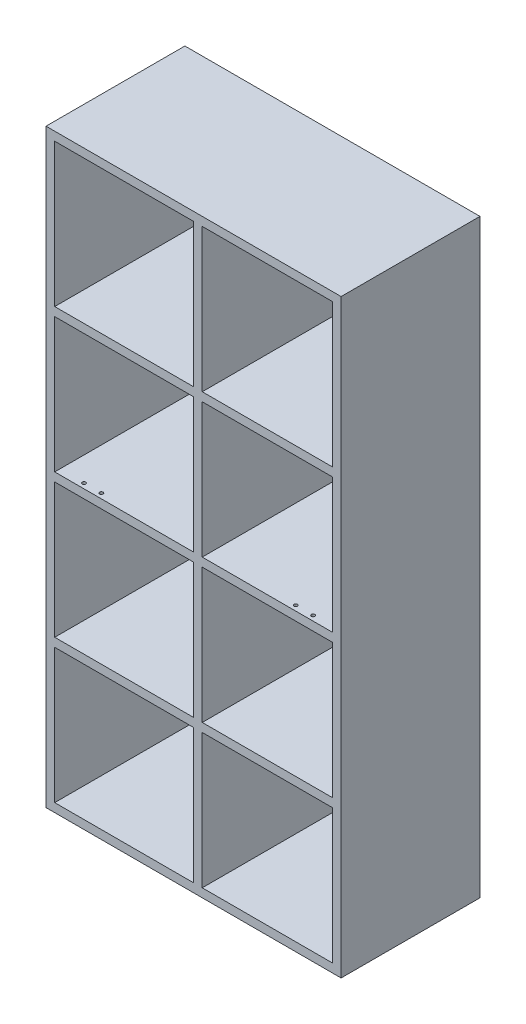
from build123d import *

# Parameters (mm, degrees)
SZKIC1_W                          = 850
SZKIC1_H                          = 1700
SZKIC1_W_2                        = 800
SZKIC1_H_2                        = 1650
SZKIC1_H_3                        = 25
SZKIC1_W_3                        = 25
WYCI_GNI_CIE_CIENKA_CIANKA1_DEPTH = 400
SZKIC2_R                          = 5
WYTNIJ_WYCI_GNI_CIE1_DEPTH        = 25
SZKIC4_R                          = 5
WYTNIJ_WYCI_GNI_CIE2_DEPTH        = 25
SZKIC6_R                          = 5
WYTNIJ_WYCI_GNI_CIE3_DEPTH        = 40


with BuildPart() as part:
    # Szkic1 → Wyciągnięcie-cienka ścianka1 (new body)
    # profile 1 of 5: a face of its own
    with BuildSketch(Plane.XY):
        with Locations((400, 825)):
            Rectangle(SZKIC1_W, SZKIC1_H)
        with Locations((400, 825)):
            Rectangle(SZKIC1_W_2, SZKIC1_H_2, mode=Mode.SUBTRACT)
    # profile 2 of 5: a face of its own
    with BuildSketch(Plane.XY):
        with Locations((400, 400)):
            Rectangle(SZKIC1_W_2, SZKIC1_H_3)
    # profile 3 of 5: a face of its own
    with BuildSketch(Plane.XY):
        with Locations((412.5, 825)):
            Rectangle(SZKIC1_W_3, SZKIC1_H_2)
    # profile 4 of 5: a face of its own
    with BuildSketch(Plane.XY):
        with Locations((400, 812.5)):
            Rectangle(SZKIC1_W_2, SZKIC1_H_3)
    # profile 5 of 5: a face of its own
    with BuildSketch(Plane.XY):
        with Locations((400, 1225)):
            Rectangle(SZKIC1_W_2, SZKIC1_H_3)
    extrude(amount=WYCI_GNI_CIE_CIENKA_CIANKA1_DEPTH)

    # Szkic2 → Wytnij-wyciągnięcie1 (cut)
    with BuildSketch(Plane(origin=(0, 825, 0), x_dir=(1, 0, 0), z_dir=(0, 1, 0))):
        with Locations(Location((70, -385.65, 0), (0, 0, 270))):
            Circle(SZKIC2_R)
        with Locations(Location((120, -385.65, 0), (0, 0, 270))):
            Circle(SZKIC2_R)
    extrude(amount=-WYTNIJ_WYCI_GNI_CIE1_DEPTH, mode=Mode.SUBTRACT)

    # Szkic4 → Wytnij-wyciągnięcie2 (cut)
    with BuildSketch(Plane(origin=(0, 825, 0), x_dir=(1, 0, 0), z_dir=(0, 1, 0))):
        with Locations(Location((730, -385.65, 0), (0, 0, 270))):
            Circle(SZKIC4_R)
        with Locations(Location((680, -385.65, 0), (0, 0, 270))):
            Circle(SZKIC4_R)
    extrude(amount=-WYTNIJ_WYCI_GNI_CIE2_DEPTH, mode=Mode.SUBTRACT)

    # Szkic6 → Wytnij-wyciągnięcie3 (cut)
    with BuildSketch(Plane.ZY.offset(25)):
        with Locations(Location((72.001673976, 1663, 0), (0, 0, 270))):
            Circle(SZKIC6_R)
        with Locations(Location((152.811673976, 1663, 0), (0, 0, 270))):
            Circle(SZKIC6_R)
    extrude(amount=-WYTNIJ_WYCI_GNI_CIE3_DEPTH, mode=Mode.SUBTRACT)


solid = part.part
